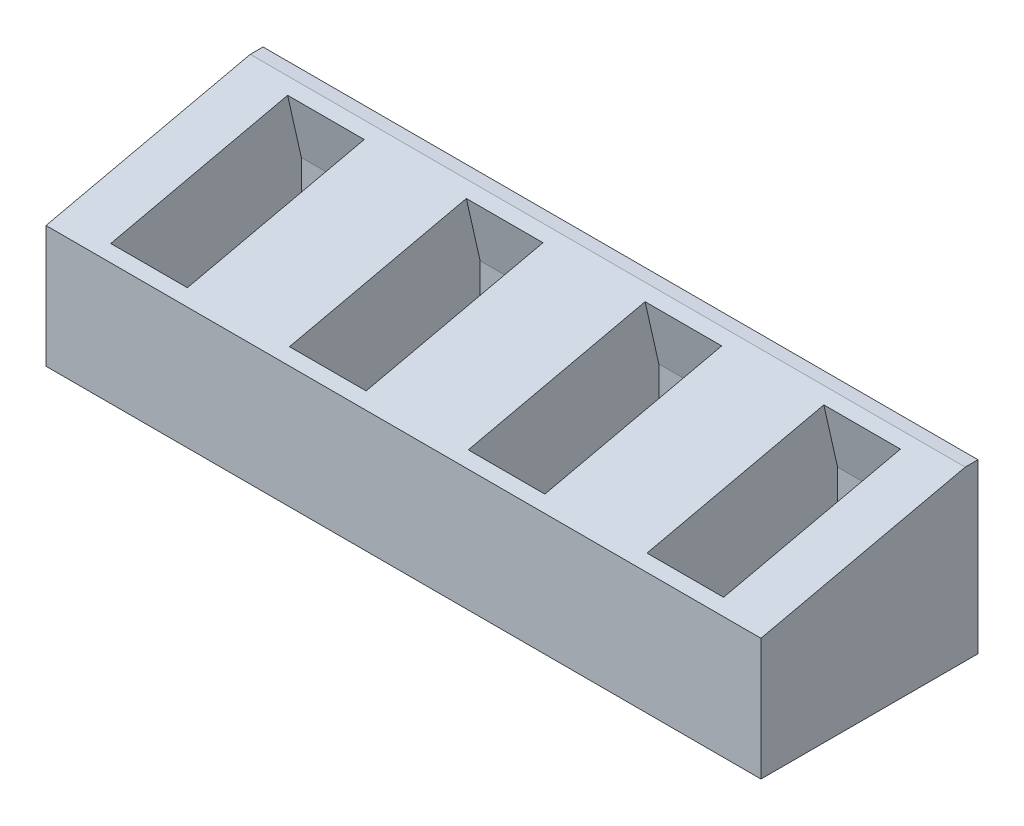
from build123d import *

# Parameters (mm, degrees)
SKETCH1_W           = 711.2
SKETCH1_H           = 167.132
BOSS_EXTRUDE2_DEPTH = 203.2
CUT_EXTRUDE3_DEPTH  = 919.48
SKETCH6_W           = 76.2
SKETCH6_H           = 180.34
CUT_EXTRUDE5_DEPTH  = 114.3
SKETCH7_W           = 711.2
SKETCH7_H           = 167.132
BOSS_EXTRUDE3_DEPTH = 12.7


with BuildPart() as part:
    # Sketch1 → Boss-Extrude2 (new body)
    with BuildSketch(Plane.XY):
        with Locations((355.6, 83.566)):
            Rectangle(SKETCH1_W, SKETCH1_H)
    extrude(amount=BOSS_EXTRUDE2_DEPTH)

    # Sketch5 → Cut-Extrude3 (cut)
    with BuildSketch(Plane(origin=(711.2, 0, 0), x_dir=(0, 0, -1), z_dir=(1, 0, 0))):
        Polygon((0, 167.132), (-203.2, 121.275720121), (-203.2, 167.132), align=None)
    extrude(amount=-CUT_EXTRUDE3_DEPTH, mode=Mode.SUBTRACT)

    # Sketch6 → Cut-Extrude5 (cut)
    with BuildSketch(Plane(origin=(0, 159.032892036, 35.88905909), x_dir=(1, 0, 0), z_dir=(0, 0.9754694514544971, 0.22013484340072725))):
        with Locations((266.7, -67.363402116)):
            Rectangle(SKETCH6_W, SKETCH6_H)
        with Locations((88.9, -67.363402116)):
            Rectangle(SKETCH6_W, SKETCH6_H)
        with Locations((444.5, -67.363402116)):
            Rectangle(SKETCH6_W, SKETCH6_H)
        with Locations((622.3, -67.363402116)):
            Rectangle(SKETCH6_W, SKETCH6_H)
    extrude(amount=-CUT_EXTRUDE5_DEPTH, mode=Mode.SUBTRACT)

    # Sketch7 → Boss-Extrude3 (add)
    with BuildSketch(Plane(origin=(0, 0, 0), x_dir=(-1, 0, 0), z_dir=(0, 0, -1))):
        with Locations((-355.6, 83.566)):
            Rectangle(SKETCH7_W, SKETCH7_H)
    extrude(amount=BOSS_EXTRUDE3_DEPTH)


solid = part.part
